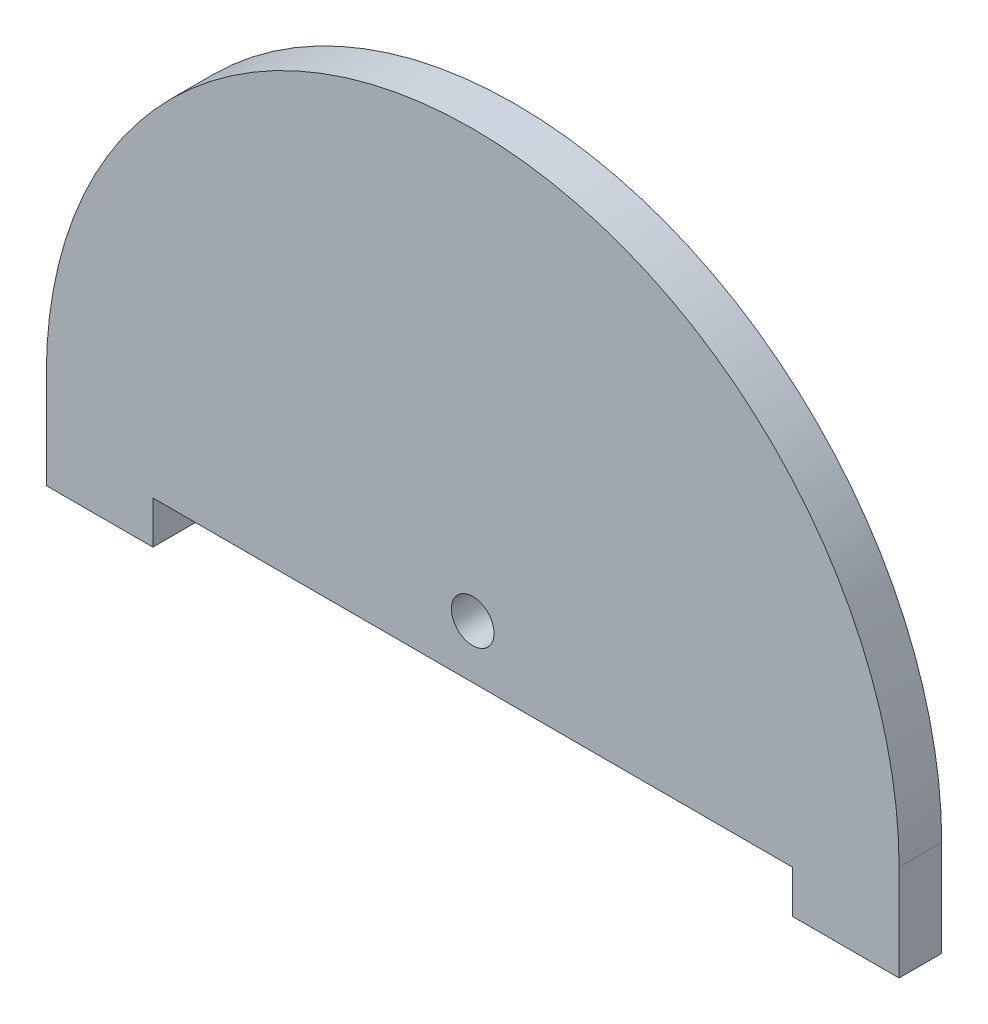
from build123d import *

# Parameters (mm, degrees)
BOSS_EXTRUDE1_DEPTH = 8
SKETCH5_W           = 160
SKETCH5_H           = 8
BOSS_EXTRUDE4_DEPTH = 10
SKETCH6_W           = 20
SKETCH6_H           = 8
BOSS_EXTRUDE5_DEPTH = 8
SKETCH7_R           = 4
CUT_EXTRUDE2_DEPTH  = 8


with BuildPart() as part:
    # Sketch1 → Boss-Extrude1 (new body)
    with BuildSketch(Plane.XY):
        with BuildLine():
            Line((-80, 0), (80, 0))
            ThreePointArc((80, 0), (0, 80), (-80, 0))
        make_face()
    extrude(amount=BOSS_EXTRUDE1_DEPTH)

    # Sketch5 → Boss-Extrude4 (add)
    with BuildSketch(Plane.XZ):
        with Locations((0, 4)):
            Rectangle(SKETCH5_W, SKETCH5_H)
    extrude(amount=BOSS_EXTRUDE4_DEPTH)

    # Sketch6 → Boss-Extrude5 (add)
    with BuildSketch(Plane.XZ.offset(10)):
        with Locations((-70, 4)):
            Rectangle(SKETCH6_W, SKETCH6_H)
    boss_extrude5 = extrude(amount=BOSS_EXTRUDE5_DEPTH)

    # Mirror2: Boss-Extrude5 across plane
    add(boss_extrude5.mirror(Plane(origin=(0, 0, 0), x_dir=(0, 0, 1), z_dir=(1, 0, 0))))

    # Sketch7 → Cut-Extrude2 (cut)
    with BuildSketch(Plane.XY.offset(8)):
        Circle(SKETCH7_R)
    extrude(amount=-CUT_EXTRUDE2_DEPTH, mode=Mode.SUBTRACT)


solid = part.part
